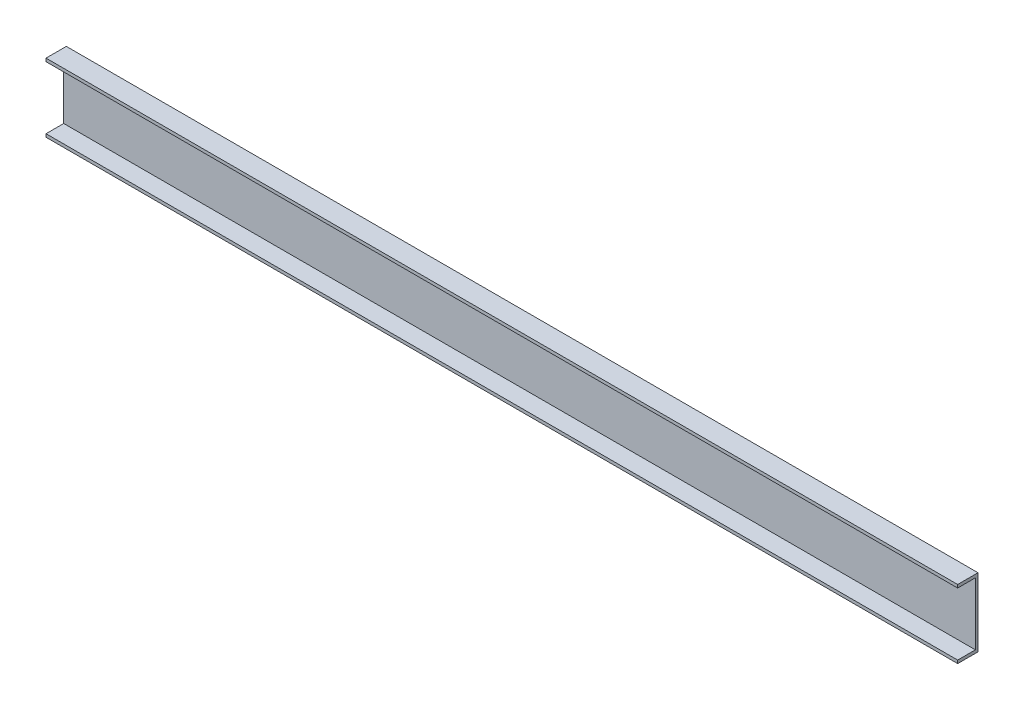
from build123d import *

# Parameters (mm, degrees)
SKETCH_1_W          = 3990
SKETCH_1_H          = 300
SKETCH_1_R          = 13
EXTRUDE_771_DEPTH   = 11.5
SKETCH_2_W          = 3990
SKETCH_2_H          = 13.5
EXTRUDE_1_DEPTH     = 77.5
SKETCH_3_W          = 70
SKETCH_3_H          = 230
EXTRUDE_2_DEPTH     = 16
SKETCH_4_R          = 13
CUT_EXTRUDE_1_DEPTH = 2004.38463606
SKETCH_5_W          = 3990
SKETCH_5_H          = 273
EXTRUDE_3_DEPTH     = 11.5
SKETCH_6_W          = 70
SKETCH_6_H          = 230
EXTRUDE_4_DEPTH     = 16


with BuildPart() as part:
    # 草图1 → Extrude 771 (new body)
    with BuildSketch(Plane.XY):
        Rectangle(SKETCH_1_W, SKETCH_1_H)
        with Locations((1940, 0)):
            Circle(SKETCH_1_R, mode=Mode.SUBTRACT)
        with Locations((1860, 0)):
            Circle(SKETCH_1_R, mode=Mode.SUBTRACT)
        with Locations((1780, 0)):
            Circle(SKETCH_1_R, mode=Mode.SUBTRACT)
        with Locations((1700, 0)):
            Circle(SKETCH_1_R, mode=Mode.SUBTRACT)
        with Locations((1700, 80)):
            Circle(SKETCH_1_R, mode=Mode.SUBTRACT)
        with Locations((1780, 80)):
            Circle(SKETCH_1_R, mode=Mode.SUBTRACT)
        with Locations((1860, 80)):
            Circle(SKETCH_1_R, mode=Mode.SUBTRACT)
        with Locations((1940, 80)):
            Circle(SKETCH_1_R, mode=Mode.SUBTRACT)
        with Locations(Location((1940, -80, 0), (0, 0, 180))):
            Circle(SKETCH_1_R, mode=Mode.SUBTRACT)
        with Locations(Location((1860, -80, 0), (0, 0, 180))):
            Circle(SKETCH_1_R, mode=Mode.SUBTRACT)
        with Locations(Location((1780, -80, 0), (0, 0, 180))):
            Circle(SKETCH_1_R, mode=Mode.SUBTRACT)
        with Locations(Location((1700, -80, 0), (0, 0, 180))):
            Circle(SKETCH_1_R, mode=Mode.SUBTRACT)
        with Locations((-1700, -80)):
            Circle(SKETCH_1_R, mode=Mode.SUBTRACT)
        with Locations((-1780, -80)):
            Circle(SKETCH_1_R, mode=Mode.SUBTRACT)
        with Locations((-1860, -80)):
            Circle(SKETCH_1_R, mode=Mode.SUBTRACT)
        with Locations((-1940, -80)):
            Circle(SKETCH_1_R, mode=Mode.SUBTRACT)
        with Locations(Location((-1940, 80, 0), (0, 0, 180))):
            Circle(SKETCH_1_R, mode=Mode.SUBTRACT)
        with Locations(Location((-1860, 80, 0), (0, 0, 180))):
            Circle(SKETCH_1_R, mode=Mode.SUBTRACT)
        with Locations(Location((-1780, 80, 0), (0, 0, 180))):
            Circle(SKETCH_1_R, mode=Mode.SUBTRACT)
        with Locations(Location((-1700, 80, 0), (0, 0, 180))):
            Circle(SKETCH_1_R, mode=Mode.SUBTRACT)
        with Locations(Location((-1700, 0, 0), (0, 0, 180))):
            Circle(SKETCH_1_R, mode=Mode.SUBTRACT)
        with Locations(Location((-1780, 0, 0), (0, 0, 180))):
            Circle(SKETCH_1_R, mode=Mode.SUBTRACT)
        with Locations(Location((-1860, 0, 0), (0, 0, 180))):
            Circle(SKETCH_1_R, mode=Mode.SUBTRACT)
        with Locations(Location((-1940, 0, 0), (0, 0, 180))):
            Circle(SKETCH_1_R, mode=Mode.SUBTRACT)
        with Locations((60, 80)):
            Circle(SKETCH_1_R, mode=Mode.SUBTRACT)
        with Locations((140, 80)):
            Circle(SKETCH_1_R, mode=Mode.SUBTRACT)
        with Locations(Location((140, -80, 0), (0, 0, 180))):
            Circle(SKETCH_1_R, mode=Mode.SUBTRACT)
        with Locations(Location((60, -80, 0), (0, 0, 180))):
            Circle(SKETCH_1_R, mode=Mode.SUBTRACT)
        with Locations((-60, -80)):
            Circle(SKETCH_1_R, mode=Mode.SUBTRACT)
        with Locations((-140, -80)):
            Circle(SKETCH_1_R, mode=Mode.SUBTRACT)
        with Locations(Location((-140, 80, 0), (0, 0, 180))):
            Circle(SKETCH_1_R, mode=Mode.SUBTRACT)
        with Locations(Location((-60, 80, 0), (0, 0, 180))):
            Circle(SKETCH_1_R, mode=Mode.SUBTRACT)
    extrude(amount=EXTRUDE_771_DEPTH)

    # 草图2 → 凸台-拉伸1 (add)
    with BuildSketch(Plane.XY.offset(11.5)):
        with Locations((0, 143.25)):
            Rectangle(SKETCH_2_W, SKETCH_2_H)
        with Locations((0, -143.25)):
            Rectangle(SKETCH_2_W, SKETCH_2_H)
    extrude(amount=EXTRUDE_1_DEPTH)

    # 草图3 → 凸台-拉伸2 (add)
    with BuildSketch(Plane(origin=(0, 0, 0), x_dir=(-1, 0, 0), z_dir=(0, 0, -1))):
        with Locations((-1300, 0)):
            Rectangle(SKETCH_3_W, SKETCH_3_H)
        with Locations((-900, 0)):
            Rectangle(SKETCH_3_W, SKETCH_3_H)
        with Locations((-500, 0)):
            Rectangle(SKETCH_3_W, SKETCH_3_H)
        with Locations((500, 0)):
            Rectangle(SKETCH_3_W, SKETCH_3_H)
        with Locations((900, 0)):
            Rectangle(SKETCH_3_W, SKETCH_3_H)
        with Locations((1300, 0)):
            Rectangle(SKETCH_3_W, SKETCH_3_H)
    extrude(amount=EXTRUDE_2_DEPTH)

    # 草图4 → 切除-拉伸1 (cut, through all)
    with BuildSketch(Plane(origin=(0, 0, -16), x_dir=(-1, 0, 0), z_dir=(0, 0, -1))):
        with Locations((-1300, 0)):
            Circle(SKETCH_4_R)
        with Locations((-1300, 80)):
            Circle(SKETCH_4_R)
        with Locations((-900, 80)):
            Circle(SKETCH_4_R)
        with Locations((-900, 0)):
            Circle(SKETCH_4_R)
        with Locations((-500, 80)):
            Circle(SKETCH_4_R)
        with Locations((-500, 0)):
            Circle(SKETCH_4_R)
        with Locations(Location((-500, -80, 0), (0, 0, 180))):
            Circle(SKETCH_4_R)
        with Locations(Location((-900, -80, 0), (0, 0, 180))):
            Circle(SKETCH_4_R)
        with Locations(Location((-1300, -80, 0), (0, 0, 180))):
            Circle(SKETCH_4_R)
        with Locations((1300, -80)):
            Circle(SKETCH_4_R)
        with Locations((900, -80)):
            Circle(SKETCH_4_R)
        with Locations((500, -80)):
            Circle(SKETCH_4_R)
        with Locations(Location((500, 0, 0), (0, 0, 180))):
            Circle(SKETCH_4_R)
        with Locations(Location((500, 80, 0), (0, 0, 180))):
            Circle(SKETCH_4_R)
        with Locations(Location((900, 0, 0), (0, 0, 180))):
            Circle(SKETCH_4_R)
        with Locations(Location((900, 80, 0), (0, 0, 180))):
            Circle(SKETCH_4_R)
        with Locations(Location((1300, 80, 0), (0, 0, 180))):
            Circle(SKETCH_4_R)
        with Locations(Location((1300, 0, 0), (0, 0, 180))):
            Circle(SKETCH_4_R)
    extrude(amount=-CUT_EXTRUDE_1_DEPTH, mode=Mode.SUBTRACT)

    # 草图5 → 凸台-拉伸3 (add)
    with BuildSketch(Plane.XY.offset(11.5)):
        Rectangle(SKETCH_5_W, SKETCH_5_H)
    extrude(amount=-EXTRUDE_3_DEPTH)

    # 草图6 → 凸台-拉伸4 (add)
    with BuildSketch(Plane(origin=(0, 0, 0), x_dir=(-1, 0, 0), z_dir=(0, 0, -1))):
        with Locations((-1300, 0)):
            Rectangle(SKETCH_6_W, SKETCH_6_H)
        with Locations((-900, 0)):
            Rectangle(SKETCH_6_W, SKETCH_6_H)
        with Locations((-500, 0)):
            Rectangle(SKETCH_6_W, SKETCH_6_H)
        with Locations((500, 0)):
            Rectangle(SKETCH_6_W, SKETCH_6_H)
        with Locations((900, 0)):
            Rectangle(SKETCH_6_W, SKETCH_6_H)
        with Locations((1300, 0)):
            Rectangle(SKETCH_6_W, SKETCH_6_H)
    extrude(amount=EXTRUDE_4_DEPTH)


solid = part.part
